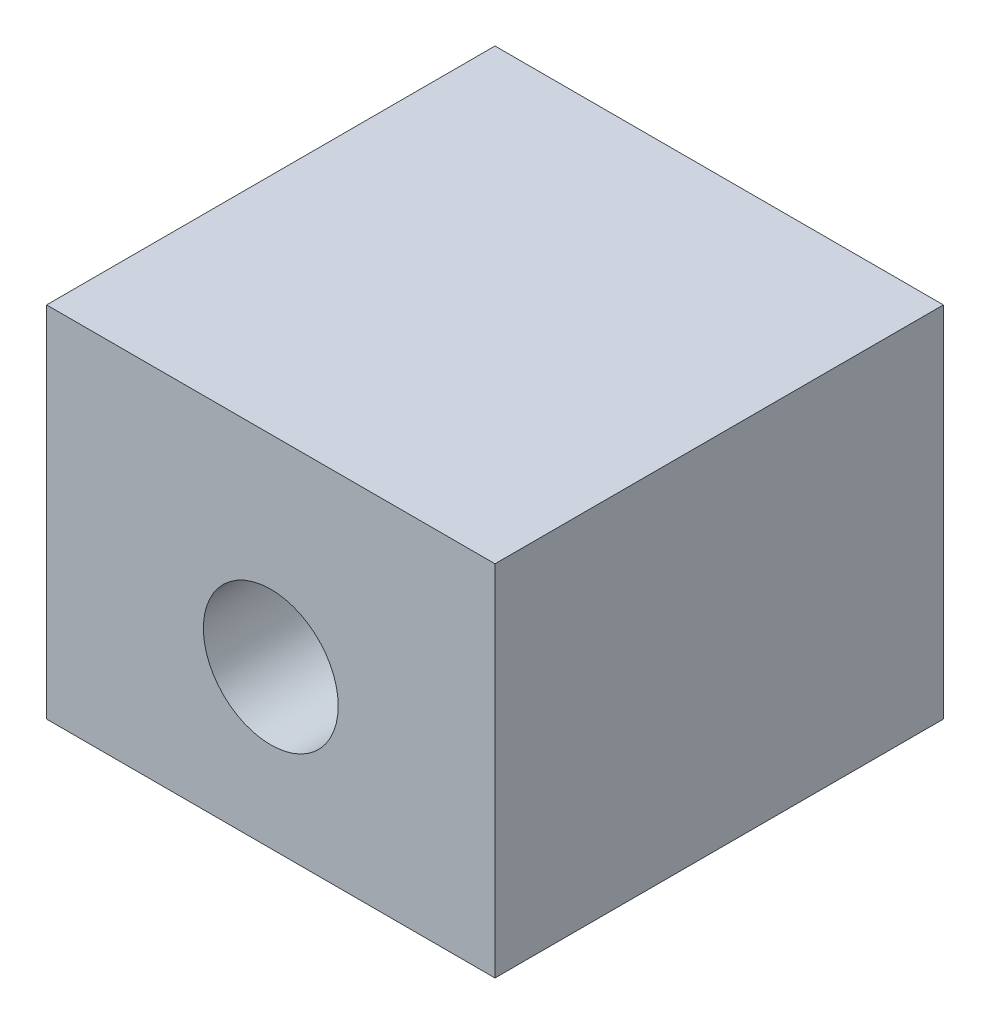
from build123d import *

# Parameters (mm, degrees)
SKETCH1_W           = 10
SKETCH1_H           = 10
BOSS_EXTRUDE1_DEPTH = 8
SKETCH2_R           = 1.503339738
CUT_EXTRUDE1_DEPTH  = 10


with BuildPart() as part:
    # Sketch1 → Boss-Extrude1 (new body)
    with BuildSketch(Plane(origin=(0, 0, 0), x_dir=(1, 0, 0), z_dir=(0, 1, 0))):
        Rectangle(SKETCH1_W, SKETCH1_H)
    extrude(amount=BOSS_EXTRUDE1_DEPTH)

    # Sketch2 → Cut-Extrude1 (cut)
    with BuildSketch(Plane.XY.offset(5)):
        with Locations((0, 3.505438306)):
            Circle(SKETCH2_R)
    extrude(amount=-CUT_EXTRUDE1_DEPTH, mode=Mode.SUBTRACT)


solid = part.part
